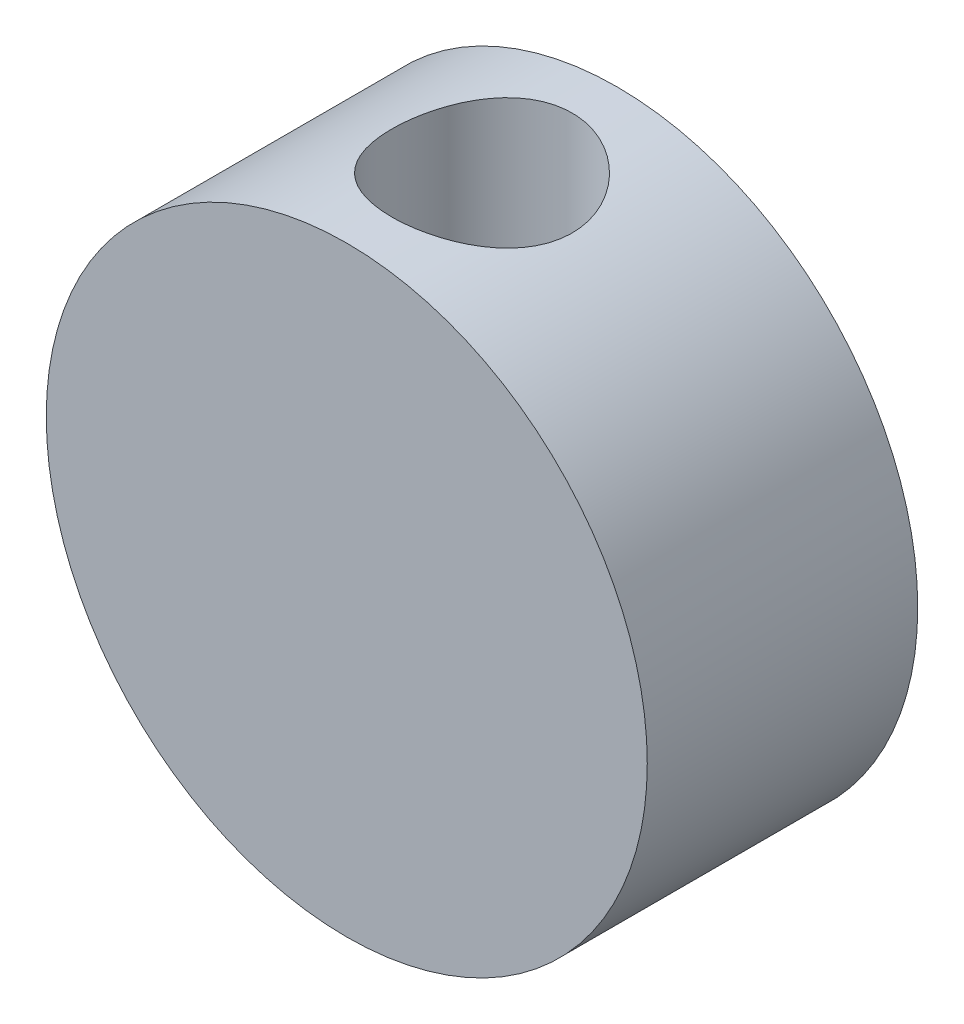
from build123d import *

# Parameters (mm, degrees)
SKETCH_1_R          = 5
EXTRUDE_1_DEPTH     = 4.5
SKETCH_2_R          = 1.5
CUT_EXTRUDE_1_DEPTH = 5


with BuildPart() as part:
    # 草图1 → 凸台-拉伸1 (new body)
    with BuildSketch(Plane.XY):
        Circle(SKETCH_1_R)
    extrude(amount=EXTRUDE_1_DEPTH)

    # 草图2 → 切除-拉伸1 (cut, symmetric)
    with BuildSketch(Plane(origin=(0, 0, 0), x_dir=(1, 0, 0), z_dir=(0, 1, 0))):
        with Locations(Location((0, -2.25, 0), (0, 0, 270))):
            Circle(SKETCH_2_R)
    extrude(amount=CUT_EXTRUDE_1_DEPTH, both=True, mode=Mode.SUBTRACT)


solid = part.part
